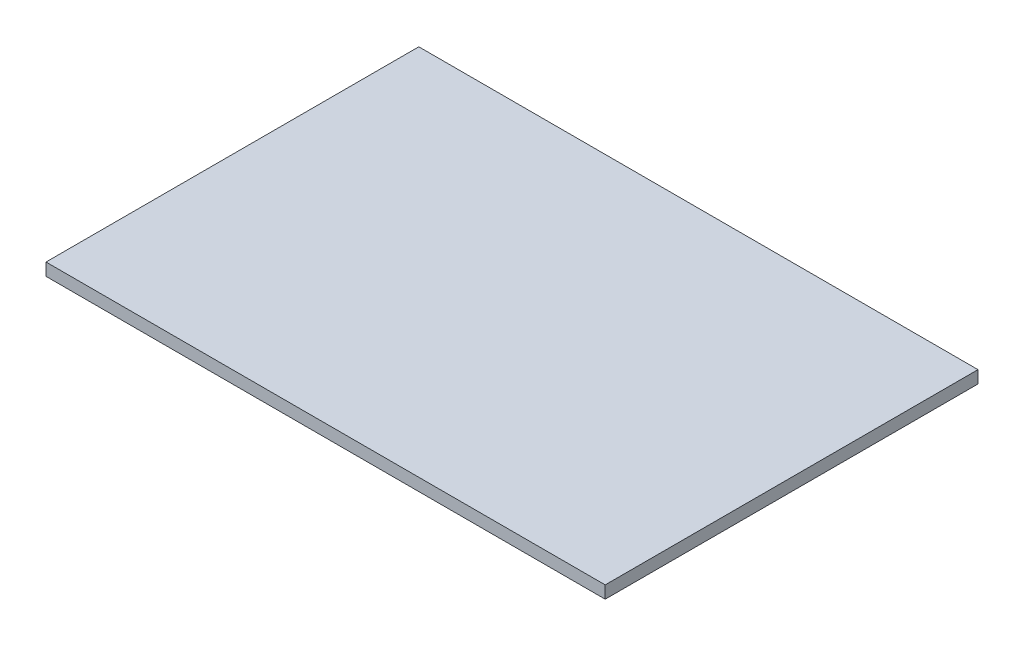
from build123d import *

# Parameters (mm, degrees)
SKETCH1_W           = 180
SKETCH1_H           = 120
BOSS_EXTRUDE1_DEPTH = 4


with BuildPart() as part:
    # Sketch1 → Boss-Extrude1 (new body)
    with BuildSketch(Plane(origin=(0, 0, 0), x_dir=(1, 0, 0), z_dir=(0, 1, 0))):
        Rectangle(SKETCH1_W, SKETCH1_H)
    extrude(amount=BOSS_EXTRUDE1_DEPTH)


solid = part.part
